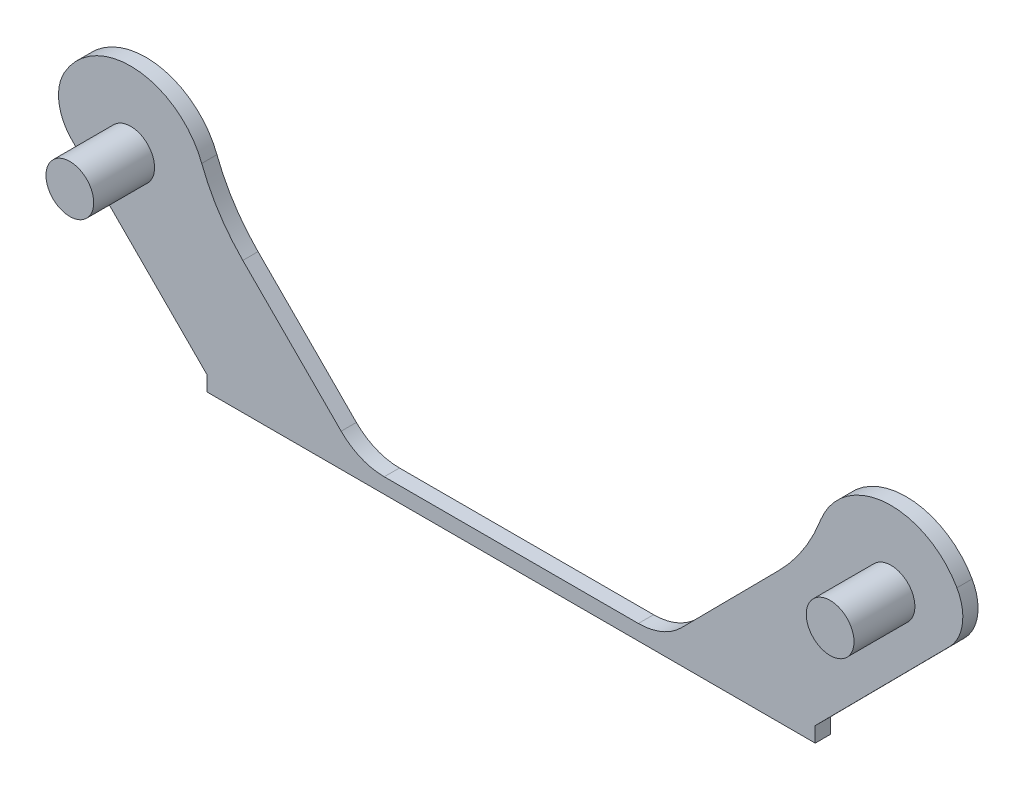
from build123d import *

# Parameters (mm, degrees)
SKETCH1_R           = 3.9878
BOSS_EXTRUDE1_DEPTH = 2.54
SKETCH1_4_R         = 3.9878
BOSS_EXTRUDE2_DEPTH = 12.7
SKETCH1_5_R         = 3.9878
BOSS_EXTRUDE3_DEPTH = 12.7


with BuildPart() as part:
    # Sketch1 → Boss-Extrude1 (new body)
    with BuildSketch(Plane.XY):
        with BuildLine():
            Line((50.8, 0), (-50.8, 0))
            Line((-50.8, 0), (-50.8, 2.54))
            Line((-50.8, 2.54), (-73.341153043, 25.177744556))
            ThreePointArc((-73.341153043, 25.177744556), (-75.4914777, 29.523776435), (-74.584603309, 34.287122743))
            ThreePointArc((-74.584603309, 34.287122743), (-62.581465352, 40.735598954), (-51.642336586, 32.611952722))
            ThreePointArc((-51.642336586, 32.611952722), (-48.766264236, 26.956085459), (-44.781504954, 22.018239761))
            Line((-44.781504954, 22.018239761), (-28.364783953, 5.531171163))
            ThreePointArc((-28.364783953, 5.531171163), (-25.06333146, 3.317545604), (-21.165235834, 2.54))
            Line((-21.165235834, 2.54), (21.267773614, 2.54))
            ThreePointArc((21.267773614, 2.54), (25.176615334, 3.322017466), (28.483728216, 5.547685746))
            Line((28.483728216, 5.547685746), (44.820167783, 22.029484797))
            ThreePointArc((44.820167783, 22.029484797), (48.778264576, 26.952668705), (51.636518818, 32.586020523))
            ThreePointArc((51.636518818, 32.586020523), (62.503979201, 40.675909873), (74.455285467, 34.295135356))
            ThreePointArc((74.455285467, 34.295135356), (75.377410668, 29.530967861), (73.236533925, 25.176171243))
            Line((73.236533925, 25.176171243), (50.8, 2.54))
            Line((50.8, 2.54), (50.8, 0))
        make_face()
        with Locations((-63.506812189, 28.062524772)):
            Circle(SKETCH1_R, mode=Mode.SUBTRACT)
        with Locations((63.448715782, 28.062524772)):
            Circle(SKETCH1_R, mode=Mode.SUBTRACT)
    extrude(amount=BOSS_EXTRUDE1_DEPTH)


with BuildPart() as body_2:
    # Sketch1<4> → Boss-Extrude2 (new body)
    with BuildSketch(Plane.XY):
        with Locations((-63.506812189, 28.062524772)):
            Circle(SKETCH1_4_R)
    extrude(amount=BOSS_EXTRUDE2_DEPTH)


with BuildPart() as body_3:
    # Sketch1<5> → Boss-Extrude3 (new body)
    with BuildSketch(Plane.XY):
        with Locations((63.448715782, 28.062524772)):
            Circle(SKETCH1_5_R)
    extrude(amount=BOSS_EXTRUDE3_DEPTH)


solid = Compound([part.part, body_2.part, body_3.part])
